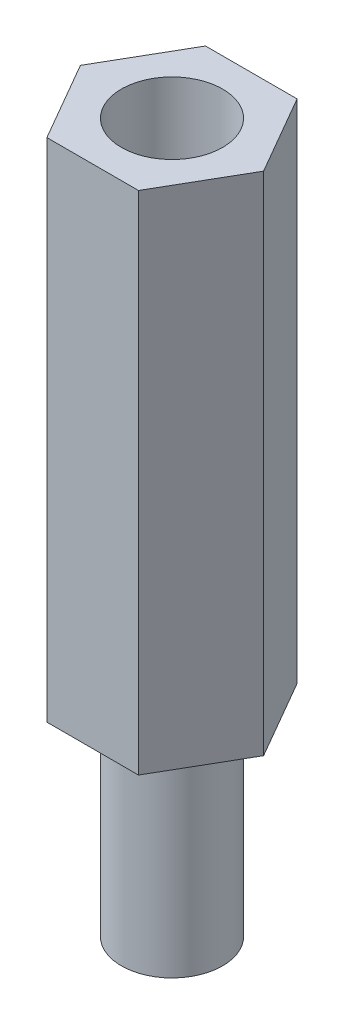
from build123d import *

# Parameters (mm, degrees)
SKETCH_1_R      = 1.5
EXTRUDE_1_DEPTH = 15
SKETCH_2_R      = 1.5
EXTRUDE_2_DEPTH = 6


with BuildPart() as part:
    # 草图1 → 凸台-拉伸1 (new body)
    with BuildSketch(Plane(origin=(0, 0, 0), x_dir=(1, 0, 0), z_dir=(0, 1, 0))):
        Polygon((2.713546265, 0), (1.356773133, 2.35), (-1.356773133, 2.35), (-2.713546265, 0), (-1.356773133, -2.35), (1.356773133, -2.35), align=None)
        with Locations(Location((0, 0, 0), (0, 0, 270))):
            Circle(SKETCH_1_R, mode=Mode.SUBTRACT)
    extrude(amount=EXTRUDE_1_DEPTH)


with BuildPart() as body_2:
    # 草图2 → 凸台-拉伸2 (new body)
    with BuildSketch(Plane(origin=(0, 0, 0), x_dir=(-1, 0, 0), z_dir=(0, -1, 0))):
        with Locations(Location((0, 0, 0), (0, 0, 90))):
            Circle(SKETCH_2_R)
    extrude(amount=EXTRUDE_2_DEPTH)


solid = Compound([part.part, body_2.part])
